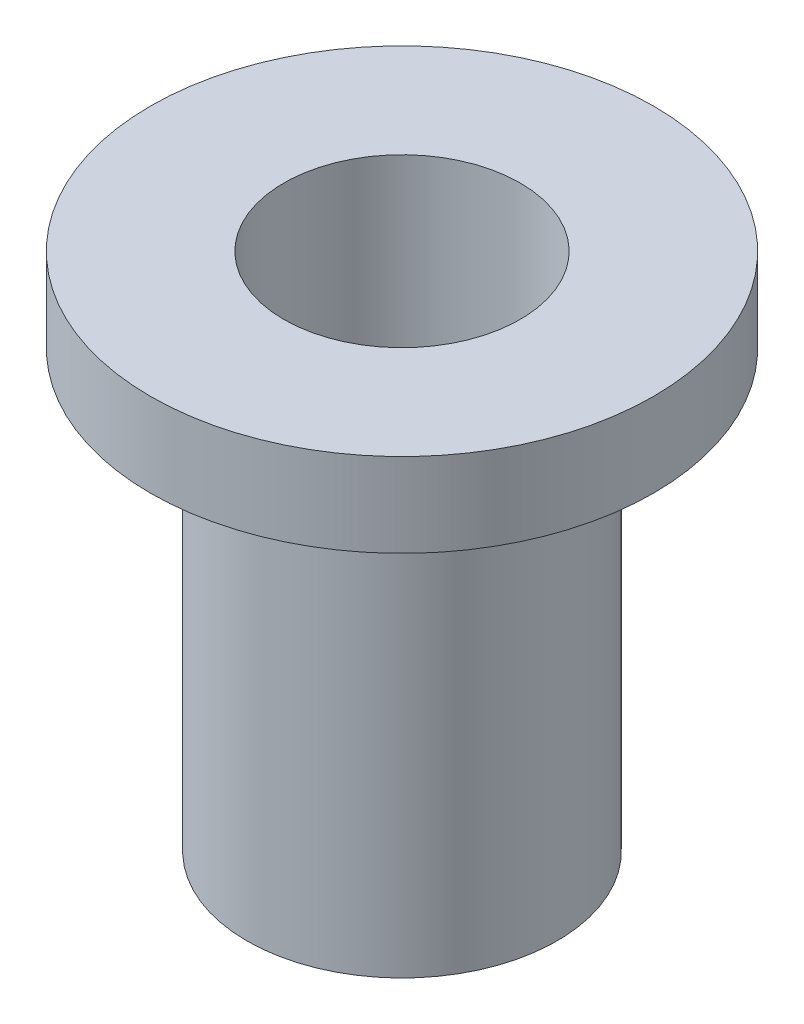
from build123d import *


with BuildPart() as part:
    # Sketch1 → Revolve1 (revolve)
    with BuildSketch(Plane.XY, mode=Mode.PRIVATE) as revolve1_sk:
        Polygon((1.7907, 193.96), (2.3495, 193.96), (2.3495, 200.564), (3.81, 200.564), (3.81, 201.834), (1.7907, 201.834), align=None)
    revolve(revolve1_sk.sketch.rotate(Axis((0, 0, 0), (0, 1, 0)), 90), axis=Axis((0, 0, 0), (0, 1, 0)))


solid = part.part
